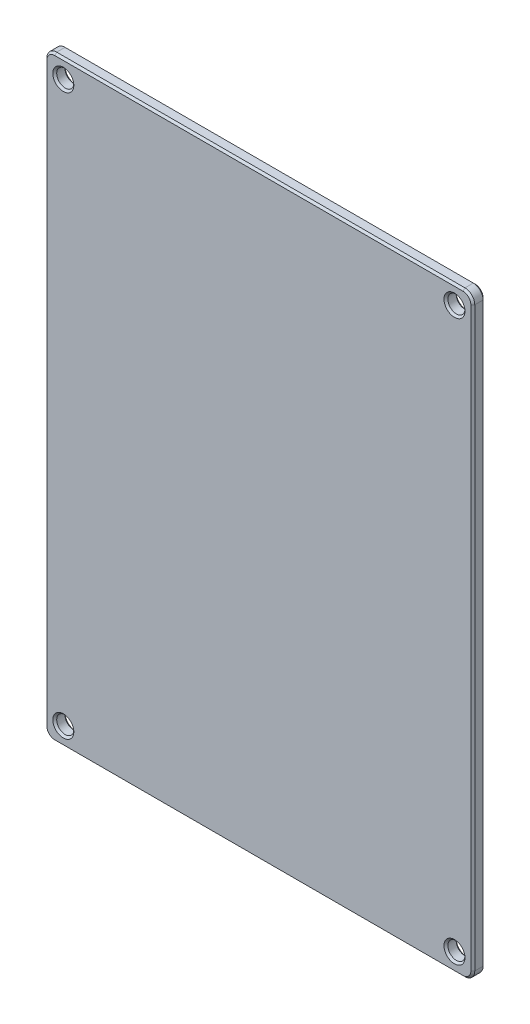
from build123d import *

# Parameters (mm, degrees)
SKIZZE1_R                       = 1.75
AUFSATZ_LINEAR_AUSTRAGEN1_DEPTH = 2.5
FASE1_SIZE                      = 0.4


with BuildPart() as part:
    # Skizze1 → Aufsatz-Linear austragen1 (new body)
    with BuildSketch(Plane(origin=(0, 0, 0), x_dir=(0, 1, 0), z_dir=(0, 0, 1))):
        with BuildLine():
            Line((59, -43.75), (-59, -43.75))
            ThreePointArc((-59, -43.75), (-60.414213562, -43.164213562), (-61, -41.75))
            Line((-61, -41.75), (-61, 41.75))
            ThreePointArc((-61, 41.75), (-60.414213562, 43.164213562), (-59, 43.75))
            Line((-59, 43.75), (59, 43.75))
            ThreePointArc((59, 43.75), (60.414213562, 43.164213562), (61, 41.75))
            Line((61, 41.75), (61, -41.75))
            ThreePointArc((61, -41.75), (60.414213562, -43.164213562), (59, -43.75))
        make_face()
        with Locations(Location((-57.25, 40, 0), (0, 0, 270))):
            Circle(SKIZZE1_R, mode=Mode.SUBTRACT)
        with Locations(Location((57.25, 40, 0), (0, 0, 90))):
            Circle(SKIZZE1_R, mode=Mode.SUBTRACT)
        with Locations(Location((57.25, -40, 0), (0, 0, 270))):
            Circle(SKIZZE1_R, mode=Mode.SUBTRACT)
        with Locations(Location((-57.25, -40, 0), (0, 0, 90))):
            Circle(SKIZZE1_R, mode=Mode.SUBTRACT)
    extrude(amount=AUFSATZ_LINEAR_AUSTRAGEN1_DEPTH)

    # Fase1
    fase1_edges = [part.edges().sort_by_distance(p)[0] for p in [
        (0, 61, 0),
        (43.164213562, 60.414213562, 0),
        (43.75, 0, 0),
        (43.164213562, -60.414213562, 0),
        (43.164213562, 60.414213562, 2.5),
        (0, 61, 2.5),
        (-43.164213562, 60.414213562, 2.5),
        (-38.25, 57.25, 0),
        (-38.25, 57.25, 2.5),
        (-43.75, 0, 2.5),
        (-41.75, -57.25, 0),
        (-41.75, -57.25, 2.5),
        (-43.164213562, -60.414213562, 2.5),
        (38.25, 57.25, 0),
        (38.25, 57.25, 2.5),
        (0, -61, 2.5),
        (41.75, -57.25, 0),
        (41.75, -57.25, 2.5),
        (43.164213562, -60.414213562, 2.5),
        (0, -61, 0),
        (43.75, 0, 2.5),
        (-43.164213562, -60.414213562, 0),
        (-43.75, 0, 0),
        (-43.164213562, 60.414213562, 0),
    ]]
    chamfer(fase1_edges, length=FASE1_SIZE)


solid = part.part
